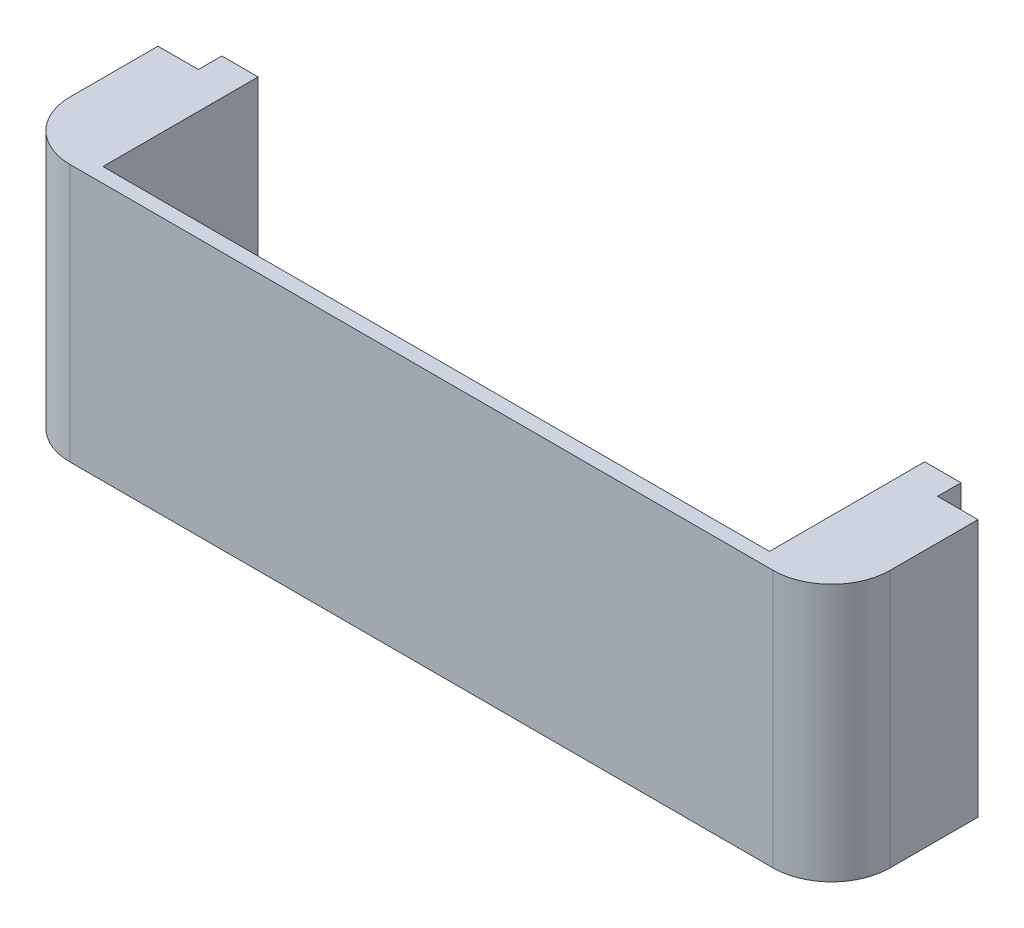
from build123d import *

# Parameters (mm, degrees)
EXTRUDE_1_DEPTH     = 14
CUT_EXTRUDE_1_DEPTH = 44
SKETCH_3_W          = 6.2
SKETCH_3_H          = 6.2
CUT_EXTRUDE_2_DEPTH = 4
SKETCH_4_R          = 4
CUT_EXTRUDE_3_DEPTH = 5
SKETCH_5_R          = 2.6
CUT_EXTRUDE_4_DEPTH = 5
SKETCH_6_R          = 4
EXTRUDE_2_DEPTH     = 10
SKETCH_7_W          = 6.2
SKETCH_7_H          = 4
EXTRUDE_3_DEPTH     = 40
CUT_EXTRUDE_5_DEPTH = 50
SKETCH_9_W          = 20
SKETCH_9_H          = 25
EXTRUDE_4_DEPTH     = 44
CUT_EXTRUDE_6_DEPTH = 44
EXTRUDE_5_DEPTH     = 44
SKETCH_12_W         = 6.9
SKETCH_12_H         = 22.5
CUT_EXTRUDE_7_DEPTH = 50


with BuildPart() as part:
    # 草图1 → 凸台-拉伸1 (new body)
    with BuildSketch(Plane.XY):
        Polygon((-15, 22), (-15, -22), (15, -22), (15, 22), (0, 22), align=None)
    extrude(amount=EXTRUDE_1_DEPTH)

    # 草图2 → 切除-拉伸1 (cut)
    with BuildSketch(Plane(origin=(0, 22, 0), x_dir=(1, 0, 0), z_dir=(0, 1, 0))):
        Polygon((-15, 0), (-15, -14), (-10, -4), (-3.1, -4), (-3.1, 0), align=None)
        Polygon((3.1, -4), (10, -4), (15, -14), (15, 0), (3.1, 0), align=None)
    extrude(amount=-CUT_EXTRUDE_1_DEPTH, mode=Mode.SUBTRACT)

    # 草图3 → 切除-拉伸2 (cut)
    with BuildSketch(Plane(origin=(0, 0, 0), x_dir=(-1, 0, 0), z_dir=(0, 0, -1))):
        Rectangle(SKETCH_3_W, SKETCH_3_H)
    extrude(amount=-CUT_EXTRUDE_2_DEPTH, mode=Mode.SUBTRACT)

    # 草图4 → 切除-拉伸3 (cut)
    with BuildSketch(Plane.XY.offset(14)):
        Circle(SKETCH_4_R)
    extrude(amount=-CUT_EXTRUDE_3_DEPTH, mode=Mode.SUBTRACT)

    # 草图5 → 切除-拉伸4 (cut)
    with BuildSketch(Plane.XY.offset(9)):
        Circle(SKETCH_5_R)
    extrude(amount=-CUT_EXTRUDE_4_DEPTH, mode=Mode.SUBTRACT)

    # 草图6 → 凸台-拉伸2 (add)
    with BuildSketch(Plane.XY.offset(14)):
        Circle(SKETCH_6_R)
    extrude(amount=-EXTRUDE_2_DEPTH)

    # 草图7 → 凸台-拉伸3 (add)
    with BuildSketch(Plane(origin=(0, -22, 0), x_dir=(-1, 0, 0), z_dir=(0, -1, 0))):
        with Locations((0, -2)):
            Rectangle(SKETCH_7_W, SKETCH_7_H)
    extrude(amount=-EXTRUDE_3_DEPTH)

    # 草图8 → 切除-拉伸5 (cut)
    with BuildSketch(Plane.XZ.offset(22)):
        Polygon((-15, 14), (-10, 4), (-10, 14), align=None)
        Polygon((15, 14), (10, 14), (10, 4), align=None)
    extrude(amount=-CUT_EXTRUDE_5_DEPTH, mode=Mode.SUBTRACT)

    # 草图9 → 凸台-拉伸4 (add)
    with BuildSketch(Plane.XZ.offset(22)):
        with Locations((0, 16.5)):
            Rectangle(SKETCH_9_W, SKETCH_9_H)
    extrude(amount=-EXTRUDE_4_DEPTH)

    # 草图10 → 切除-拉伸6 (cut)
    with BuildSketch(Plane.XZ.offset(22)):
        with BuildLine():
            Line((-10, 29), (-10, 19))
            ThreePointArc((-10, 19), (-7.071067812, 26.071067812), (0, 29))
            Line((0, 29), (-10, 29))
        make_face()
    extrude(amount=-CUT_EXTRUDE_6_DEPTH, mode=Mode.SUBTRACT)

    # 草图11 → 凸台-拉伸5 (add)
    with BuildSketch(Plane.XZ.offset(22)):
        with BuildLine():
            Line((120, 0), (123.1, 0))
            Line((123.1, 0), (123.1, 4))
            Line((123.1, 4), (130, 4))
            Line((130, 4), (130, 19))
            ThreePointArc((130, 19), (127.071067812, 26.071067812), (120, 29))
            Line((120, 29), (110, 29))
            Line((110, 29), (10, 29))
            Line((10, 29), (10, 26.5))
            Line((10, 26.5), (110, 26.5))
            Line((110, 26.5), (110, 4))
            Line((110, 4), (116.9, 4))
            Line((116.9, 4), (116.9, 0))
            Line((116.9, 0), (120, 0))
        make_face()
    extrude(amount=-EXTRUDE_5_DEPTH)

    # 草图12 → 切除-拉伸7 (cut)
    with BuildSketch(Plane(origin=(0, 22, 0), x_dir=(1, 0, 0), z_dir=(0, 1, 0))):
        with Locations((6.55, -15.25)):
            Rectangle(SKETCH_12_W, SKETCH_12_H)
        with Locations((113.45, -15.25)):
            Rectangle(SKETCH_12_W, SKETCH_12_H)
    extrude(amount=-CUT_EXTRUDE_7_DEPTH, mode=Mode.SUBTRACT)


solid = part.part
